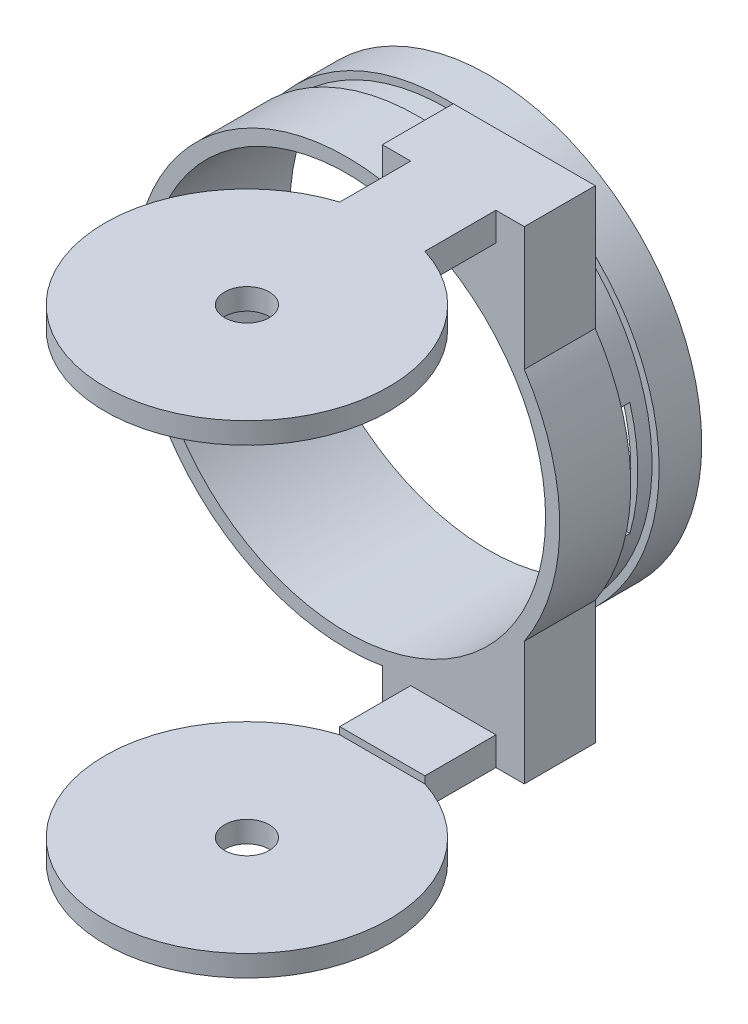
from build123d import *
from build123d.topology import SkipClean

# Parameters (mm, degrees)
SKETCH2_R                = 38.1
SKETCH2_R_2              = 35.56
BOSS_EXTRUDE1_DEPTH      = 12.7
SKETCH4_W                = 15.24
SKETCH4_H                = 5.08
BOSS_EXTRUDE2_DEPTH      = 12.7
BOSS_EXTRUDE2_2_DEPTH    = 12.7
SKETCH5_W                = 25.4
SKETCH5_H                = 5.08
BOSS_EXTRUDE4_DEPTH      = 12.7
BOSS_EXTRUDE4_2_DEPTH    = 12.7
BOSS_EXTRUDE5_REACH      = 95.291
BOSS_EXTRUDE5_END_RADIUS = 38.1
SKETCH6_W                = 25.4
SKETCH6_H                = 12.7
BOSS_EXTRUDE6_REACH      = 95.291
BOSS_EXTRUDE6_END_RADIUS = 38.1
SKETCH7_W                = 25.4
SKETCH7_H                = 12.7
SKETCH8_R                = 25.4
BOSS_EXTRUDE7_DEPTH      = 3.81
BOSS_EXTRUDE8_START      = 5.08
SKETCH9_R                = 36.83
SKETCH9_R_2              = 35.56
BOSS_EXTRUDE8_DEPTH      = 5.08
BOSS_EXTRUDE9_START      = 7.62
SKETCH10_R               = 38.1
SKETCH10_R_2             = 35.56
BOSS_EXTRUDE9_DEPTH      = 7.62
SKETCH13_W               = 2.54
SKETCH13_H               = 20.32
CUT_EXTRUDE2_DEPTH       = 98.313021537
CUT_EXTRUDE3_DEPTH       = 123.732886223
CUT_EXTRUDE3_DEPTH_BACK  = 123.732886223
SKETCH14_R               = 4


with BuildPart() as part:
    # Sketch2 → Boss-Extrude1 (new body)
    with BuildSketch(Plane.XY):
        Circle(SKETCH2_R)
        Circle(SKETCH2_R_2, mode=Mode.SUBTRACT)
    extrude(amount=BOSS_EXTRUDE1_DEPTH)



with BuildPart() as body_2:
    # Sketch4 → Boss-Extrude2 (new body)
    with BuildSketch(Plane.XY.offset(12.7)):
        with Locations((19.05, 40.64)):
            Rectangle(SKETCH4_W, SKETCH4_H)
    extrude(amount=BOSS_EXTRUDE2_DEPTH)


with BuildPart() as body_3:
    # Sketch4 → Boss-Extrude2 2 (new body)
    with BuildSketch(Plane.XY.offset(12.7)):
        with Locations((19.05, -40.64)):
            Rectangle(SKETCH4_W, SKETCH4_H)
    extrude(amount=BOSS_EXTRUDE2_2_DEPTH)


with BuildPart() as body_4:
    # Sketch5 → Boss-Extrude4 (new body)
    with BuildSketch(Plane(origin=(0, 0, 12.7), x_dir=(-1, 0, 0), z_dir=(0, 0, -1))):
        with Locations((-19.05, 40.64)):
            Rectangle(SKETCH5_W, SKETCH5_H)
    extrude(amount=BOSS_EXTRUDE4_DEPTH)


with BuildPart() as body_5:
    # Sketch5 → Boss-Extrude4 2 (new body)
    with BuildSketch(Plane(origin=(0, 0, 12.7), x_dir=(-1, 0, 0), z_dir=(0, 0, -1))):
        with Locations((-19.05, -40.64)):
            Rectangle(SKETCH5_W, SKETCH5_H)
    extrude(amount=BOSS_EXTRUDE4_2_DEPTH)


with BuildPart() as part_1:
    add(part.part)

    add(body_3.part)  # Boss-Extrude5 merges body 3

    add(body_5.part)  # Boss-Extrude5 merges body 5
    # Boss-Extrude5: up to this cylinder (the profile starts outside it)
    boss_extrude5_end = Plane(origin=(0, 0, 6.35), z_dir=(0, 0, -1)) * Cylinder(BOSS_EXTRUDE5_END_RADIUS, 267.782, mode=Mode.PRIVATE)
    # Sketch6 → Boss-Extrude5 (add, up to the surface)
    with BuildSketch(Plane(origin=(0, -38.1, 0), x_dir=(1, 0, 0), z_dir=(0, 1, 0)), mode=Mode.PRIVATE) as boss_extrude5_sk1:
        with Locations((19.05, -6.35)):
            Rectangle(SKETCH6_W, SKETCH6_H)
    boss_extrude5_tool1 = extrude(boss_extrude5_sk1.sketch, amount=BOSS_EXTRUDE5_REACH, mode=Mode.PRIVATE) - boss_extrude5_end
    add(boss_extrude5_tool1.solids().sort_by_distance((19.05, -38.1, 6.35))[0])


    add(body_2.part)  # Boss-Extrude6 merges body 2

    add(body_4.part)  # Boss-Extrude6 merges body 4
    # Boss-Extrude6: up to this cylinder (the profile starts outside it)
    boss_extrude6_end = Plane(origin=(0, 0, 6.35), z_dir=(0, 0, -1)) * Cylinder(BOSS_EXTRUDE6_END_RADIUS, 267.782, mode=Mode.PRIVATE)
    # Sketch7 → Boss-Extrude6 (add, up to the surface)
    with BuildSketch(Plane.XZ.offset(-38.1), mode=Mode.PRIVATE) as boss_extrude6_sk1:
        with Locations((19.05, 6.35)):
            Rectangle(SKETCH7_W, SKETCH7_H)
    boss_extrude6_tool1 = extrude(boss_extrude6_sk1.sketch, amount=BOSS_EXTRUDE6_REACH, mode=Mode.PRIVATE) - boss_extrude6_end
    add(boss_extrude6_tool1.solids().sort_by_distance((19.05, 38.1, 6.35))[0])

    # Sketch8 → Boss-Extrude7 (add)
    with BuildSketch(Plane(origin=(0, 43.18, 0), x_dir=(1, 0, 0), z_dir=(0, 1, 0))):
        with Locations((19.05, -49.630055716)):
            Circle(SKETCH8_R)
    boss_extrude7 = extrude(amount=-BOSS_EXTRUDE7_DEPTH)

    # Mirror1: Boss-Extrude7 across plane
    add(boss_extrude7.mirror(Plane.ZX))

    # Sketch9 → Boss-Extrude8 (add)
    with SkipClean():  # the faces are left unmerged after this step: merging them gives an invalid solid
        with BuildSketch(Plane(origin=(0, 0, 0), x_dir=(-1, 0, 0), z_dir=(0, 0, -1)).offset(BOSS_EXTRUDE8_START)):
            with Locations(Location((0, 0, 0), (0, 0, 180))):
                Circle(SKETCH9_R)
            Circle(SKETCH9_R_2, mode=Mode.SUBTRACT)
        extrude(amount=-BOSS_EXTRUDE8_DEPTH)

    # Sketch10 → Boss-Extrude9 (add)
    with SkipClean():  # the faces are left unmerged after this step: merging them gives an invalid solid
        with BuildSketch(Plane(origin=(0, 0, -5.08), x_dir=(-1, 0, 0), z_dir=(0, 0, -1)).offset(BOSS_EXTRUDE9_START)):
            with Locations(Location((0, 0, 0), (0, 0, 180))):
                Circle(SKETCH10_R)
            Circle(SKETCH10_R_2, mode=Mode.SUBTRACT)
        extrude(amount=-BOSS_EXTRUDE9_DEPTH)

    # Sketch13 → Cut-Extrude2 (cut, through all)
    with SkipClean():  # the faces are left unmerged after this step: merging them gives an invalid solid
        with BuildSketch(Plane(origin=(0, 0, 0), x_dir=(0, 0, -1), z_dir=(1, 0, 0))):
            with Locations((1.27, 0)):
                Rectangle(SKETCH13_W, SKETCH13_H)
        extrude(amount=CUT_EXTRUDE2_DEPTH, mode=Mode.SUBTRACT)

    # Sketch14 → Cut-Extrude3 (cut, two sides: drawn at the far end of the back side and taken through both)
    with SkipClean():  # the faces are left unmerged after this step: merging them gives an invalid solid
        with BuildSketch(Plane(origin=(0, 43.18, 0), x_dir=(1, 0, 0), z_dir=(0, 1, 0)).offset(-CUT_EXTRUDE3_DEPTH_BACK)):
            with Locations(Location((19.05, -49.630055716, 0), (0, 0, 270))):
                Circle(SKETCH14_R)
        extrude(amount=CUT_EXTRUDE3_DEPTH + CUT_EXTRUDE3_DEPTH_BACK, mode=Mode.SUBTRACT)


solid = part_1.part
